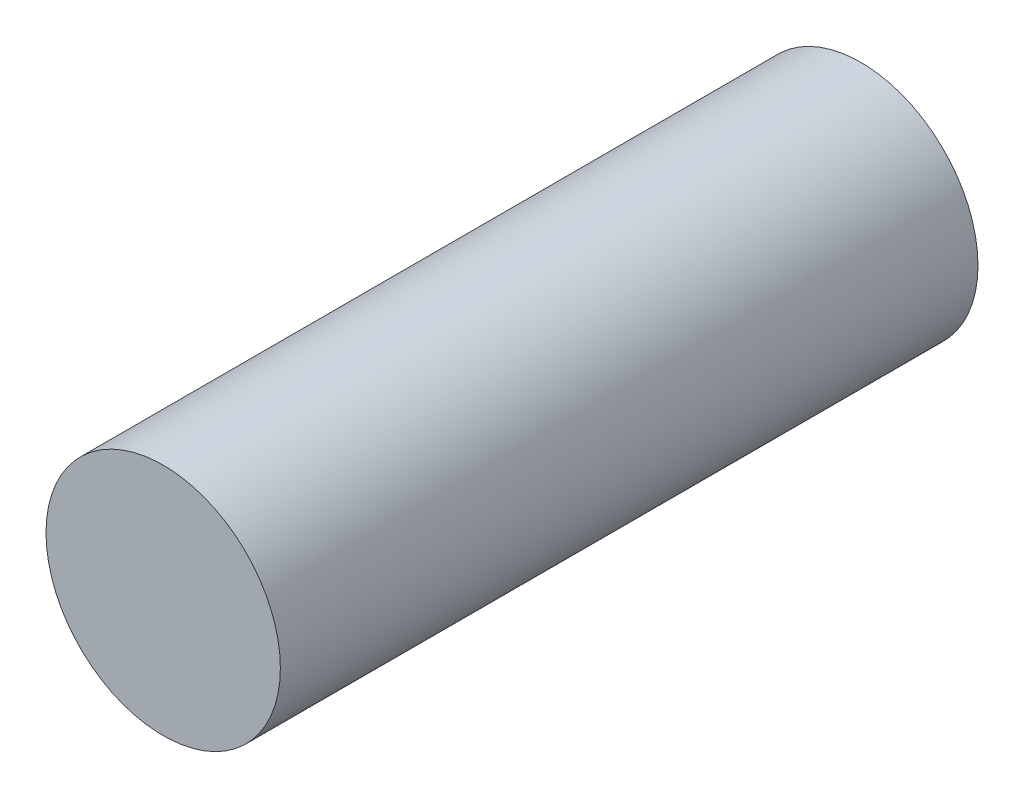
from build123d import *

# Parameters (mm, degrees)
ESQUISSE1_R        = 3
BOSS_EXTRU_1_DEPTH = 17.86


with BuildPart() as part:
    # Esquisse1 → Boss.-Extru.1 (new body)
    with BuildSketch(Plane.XY):
        Circle(ESQUISSE1_R)
    extrude(amount=BOSS_EXTRU_1_DEPTH)


solid = part.part
